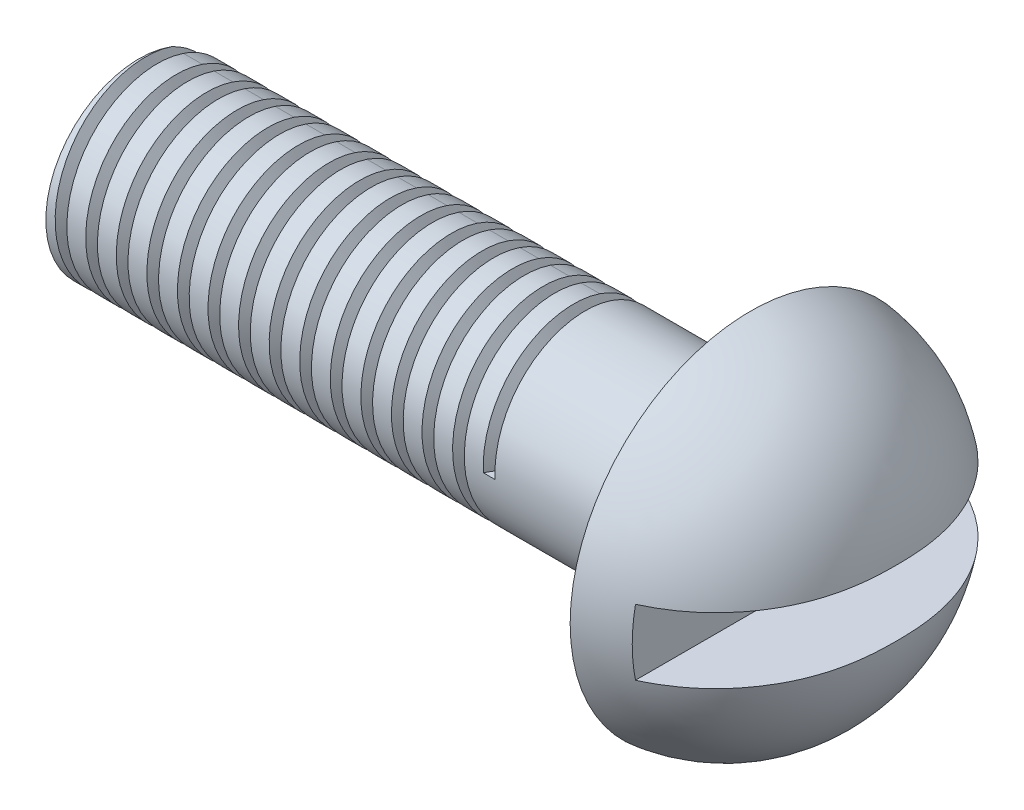
from build123d import *

# Parameters (mm, degrees)
CROQUIS2_W              = 1.26
CROQUIS2_H              = 0.43
CORTAR_EXTRUIR1_DEPTH   = 1.5
CROQUIS3_R              = 0.610008377
SALIENTE_EXTRUIR1_DEPTH = 4
CORTAR_BARRER1_PITCH    = 0.2
CORTAR_BARRER1_HEIGHT   = 3
CORTAR_BARRER1_RADIUS   = 0.610008377


with BuildPart() as part:
    # Croquis1 → Revolución1 (revolve)
    with BuildSketch(Plane.XY):
        with BuildLine():
            Line((0, 0), (0.95, 0))
            ThreePointArc((0.95, 0), (0.719386002, 0.786751442), (0, 1.18))
            Line((0, 1.18), (0, 0))
        make_face()
    revolve(axis=Axis((0, 0, 0), (1, 0, 0)))

    # Croquis2 → Cortar-Extruir1 (cut, symmetric)
    with BuildSketch(Plane.XY):
        with Locations((0.95, 0)):
            Rectangle(CROQUIS2_W, CROQUIS2_H)
    extrude(amount=CORTAR_EXTRUIR1_DEPTH, both=True, mode=Mode.SUBTRACT)

    # Croquis3 → Saliente-Extruir1 (add)
    with BuildSketch(Plane.ZY):
        Circle(CROQUIS3_R)
    extrude(amount=SALIENTE_EXTRUIR1_DEPTH)

    # Cortar-Barrer1: sweep along a helix
    with BuildLine() as cortar_barrer1_path:
        Helix(CORTAR_BARRER1_PITCH, CORTAR_BARRER1_HEIGHT, CORTAR_BARRER1_RADIUS, center=(-4, 0, 0), direction=(1, 0, 0))
    # Croquis5 → Cortar-Barrer1 (sweep, cut)
    with BuildSketch(Plane(origin=(0, 0, 0), x_dir=(1, 0, 0), z_dir=(0, 1, 0))):
        Polygon((-4, 0.543651544), (-3.942533297, 0.643186793), (-4.057466703, 0.643186793), align=None)
    sweep(path=cortar_barrer1_path.line, is_frenet=True, mode=Mode.SUBTRACT)


solid = part.part
